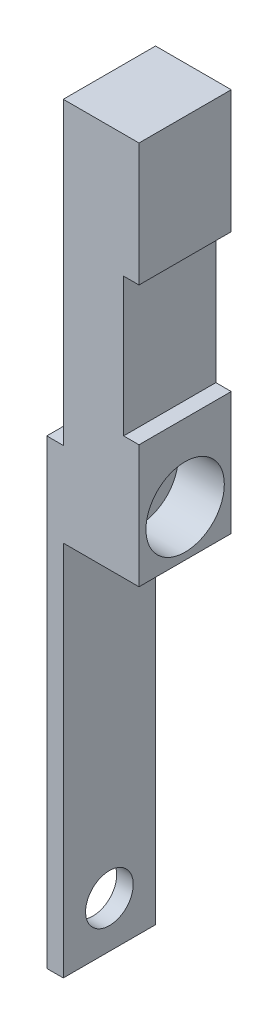
from build123d import *

# Parameters (mm, degrees)
BOSS_EXTRU_1_DEPTH           = 6
ESQUISSE2_R                  = 5.1
ENL_V_MAT_EXTRU_1_DEPTH      = 6
ESQUISSE3_R                  = 3.1
ENL_V_MAT_EXTRU_2_DEPTH      = 76.478473752
ESQUISSE4_R                  = 3.1
ENL_V_MAT_EXTRU_3_DEPTH      = 76.881634801
ENL_V_MAT_EXTRU_4_DEPTH      = 78.42133104
ENL_V_MAT_EXTRU_4_DEPTH_BACK = 78.42133104
ESQUISSE5_W                  = 13.795889793
ESQUISSE5_H                  = 18


with BuildPart() as part:
    # Esquisse1 → Boss.-Extru.1 (new, symmetric)
    with BuildSketch(Plane.XY):
        Polygon((6.25, -15), (8.4, -15), (8.4, 24), (18.25, 24), (18.25, -26), (8.4, -26), (8.4, -75), (6.25, -75), align=None)
    extrude(amount=BOSS_EXTRU_1_DEPTH, both=True)

    # Esquisse2 → Enlèv. mat.-Extru.1 (cut)
    with BuildSketch(Plane(origin=(18.25, 0, 0), x_dir=(0, 0, -1), z_dir=(1, 0, 0))):
        with Locations((0, -20)):
            Circle(ESQUISSE2_R)
    extrude(amount=-ENL_V_MAT_EXTRU_1_DEPTH, mode=Mode.SUBTRACT)

    # Esquisse3 → Enlèv. mat.-Extru.2 (cut, through all)
    with BuildSketch(Plane(origin=(12.25, 0, 0), x_dir=(0, 0, -1), z_dir=(1, 0, 0))):
        with Locations((0, -20)):
            Circle(ESQUISSE3_R)
    extrude(amount=-ENL_V_MAT_EXTRU_2_DEPTH, mode=Mode.SUBTRACT)

    # Esquisse4 → Enlèv. mat.-Extru.3 (cut, through all)
    with BuildSketch(Plane(origin=(8.4, 0, 0), x_dir=(0, 0, -1), z_dir=(1, 0, 0))):
        with Locations(Location((0, -69, 0), (0, 0, 90))):
            Circle(ESQUISSE4_R)
    extrude(amount=-ENL_V_MAT_EXTRU_3_DEPTH, mode=Mode.SUBTRACT)

    # Esquisse5 → Enlèv. mat.-Extru.4 (cut, two sides: drawn at the far end of the back side and taken through both)
    with BuildSketch(Plane.XY.offset(-ENL_V_MAT_EXTRU_4_DEPTH_BACK)):
        with Locations((23.147944897, -1)):
            Rectangle(ESQUISSE5_W, ESQUISSE5_H)
    extrude(amount=ENL_V_MAT_EXTRU_4_DEPTH + ENL_V_MAT_EXTRU_4_DEPTH_BACK, mode=Mode.SUBTRACT)


solid = part.part
